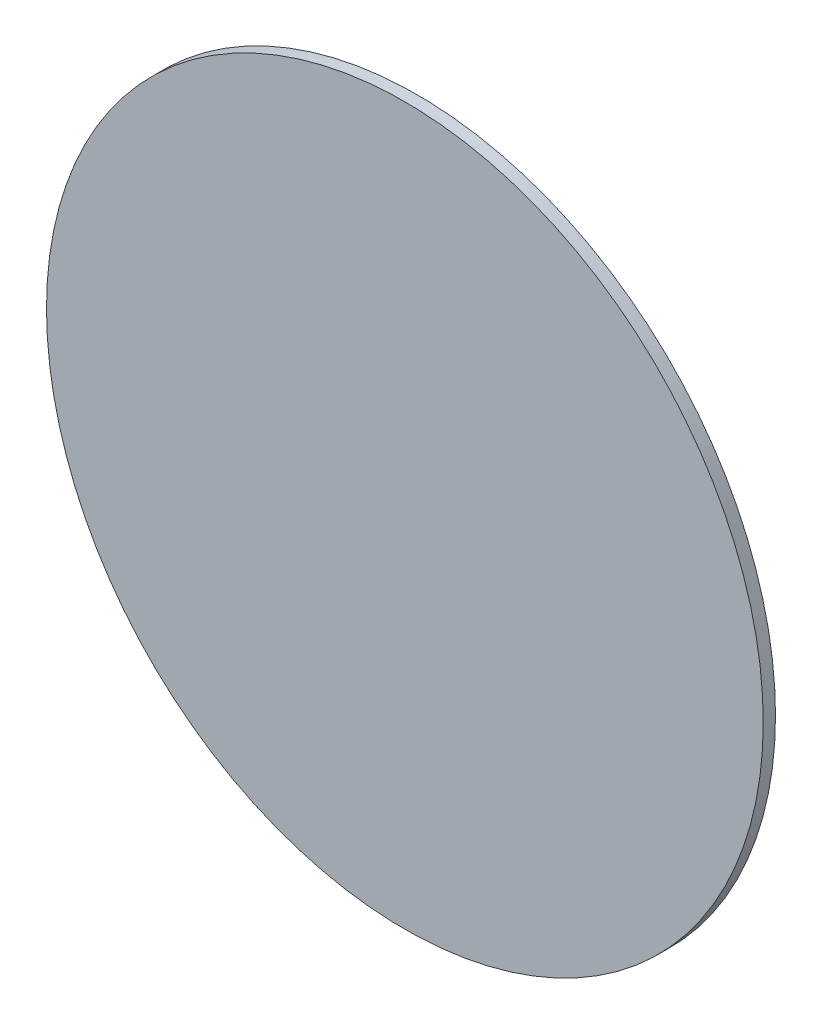
from build123d import *

# Parameters (mm, degrees)
SKETCH1_R           = 146.4
BOSS_EXTRUDE1_DEPTH = 5


with BuildPart() as part:
    # Sketch1 → Boss-Extrude1 (new body)
    with BuildSketch(Plane.XY):
        Circle(SKETCH1_R)
    extrude(amount=BOSS_EXTRUDE1_DEPTH)


solid = part.part
